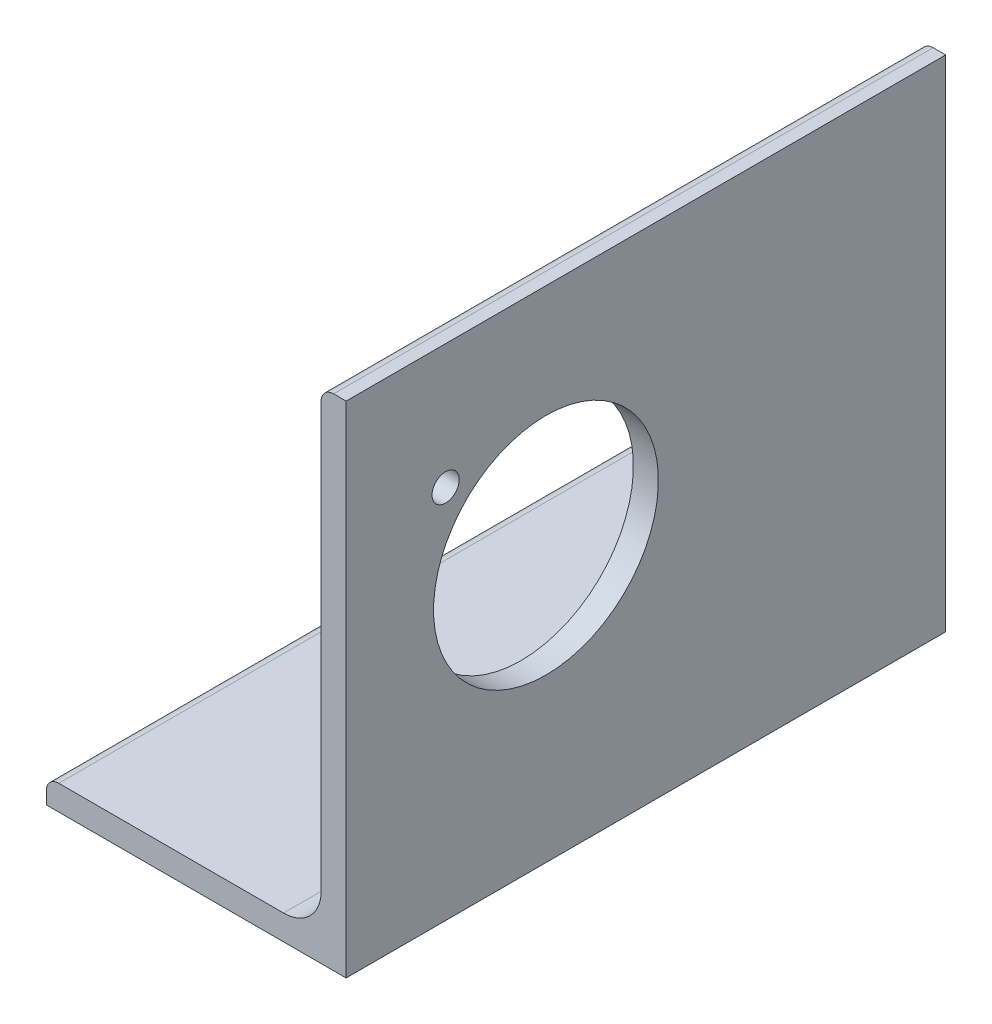
from build123d import *

# Parameters (mm, degrees)
BOSS_EXTRUDE1_DEPTH = 38.1
SKETCH3_R           = 14.2875
SKETCH3_R_2         = 1.7272
CUT_EXTRUDE1_DEPTH  = 61.658289829
SKETCH9_R           = 2.4892
CUT_EXTRUDE2_DEPTH  = 77.464125575


with BuildPart() as part:
    # Sketch2 → Boss-Extrude1 (new, symmetric)
    with BuildSketch(Plane.XY):
        with BuildLine():
            Line((-19.05, -31.75), (19.05, -31.75))
            Line((19.05, -31.75), (19.05, 31.75))
            Line((19.05, 31.75), (17.4625, 31.75))
            ThreePointArc((17.4625, 31.75), (16.339967985, 31.285032015), (15.875, 30.1625))
            Line((15.875, 30.1625), (15.875, -23.7998))
            ThreePointArc((15.875, -23.7998), (14.476376302, -27.176376302), (11.0998, -28.575))
            Line((11.0998, -28.575), (-17.4625, -28.575))
            ThreePointArc((-17.4625, -28.575), (-18.585032015, -29.039967985), (-19.05, -30.1625))
            Line((-19.05, -30.1625), (-19.05, -31.75))
        make_face()
    extrude(amount=BOSS_EXTRUDE1_DEPTH, both=True)

    # Sketch3 → Cut-Extrude1 (cut, through all)
    with BuildSketch(Plane.ZY.offset(-15.875)):
        with Locations(Location((12.70000005, 3.1797625, 0), (0, 0, 270))):
            Circle(SKETCH3_R)
        with Locations(Location((25.451963742, 15.931726192, 0), (0, 0, 270))):
            Circle(SKETCH3_R_2)
    extrude(amount=-CUT_EXTRUDE1_DEPTH, mode=Mode.SUBTRACT)

    # Sketch9 → Cut-Extrude2 (cut, through all)
    with BuildSketch(Plane.XZ.offset(31.75)):
        Circle(SKETCH9_R)
        with Locations((0, -25.4)):
            Circle(SKETCH9_R)
    extrude(amount=-CUT_EXTRUDE2_DEPTH, mode=Mode.SUBTRACT)


solid = part.part
